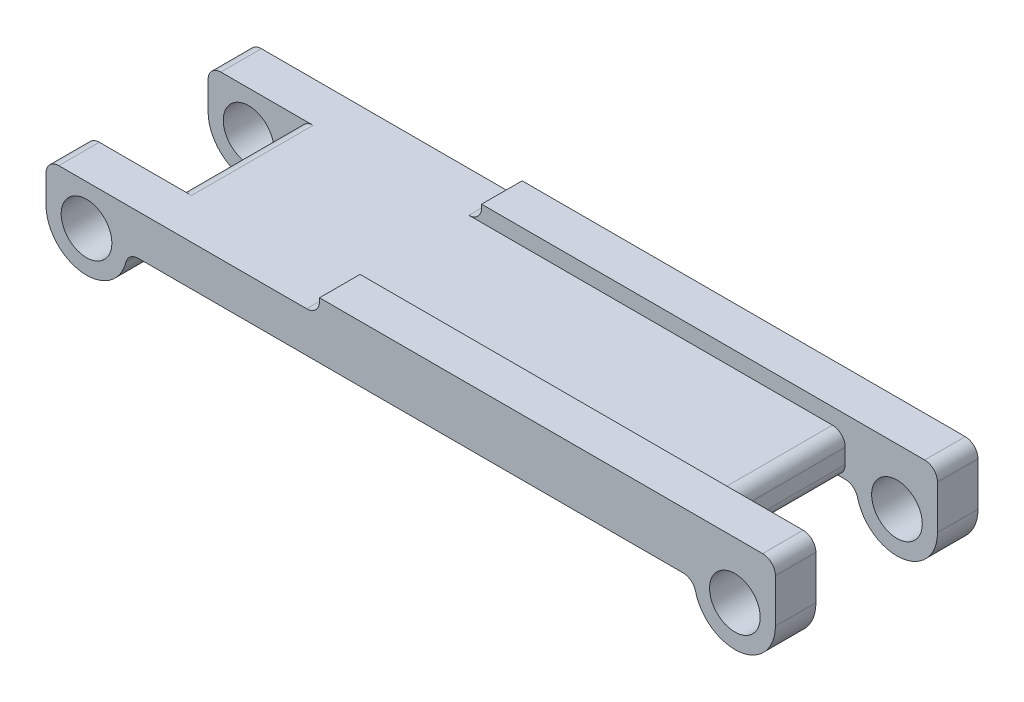
from build123d import *

# Parameters (mm, degrees)
SKETCH1_R           = 3.96875
BOSS_EXTRUDE1_DEPTH = 6.35
BOSS_EXTRUDE2_DEPTH = 19.05
SKETCH4_R           = 3.96875
BOSS_EXTRUDE3_DEPTH = 6.35


with BuildPart() as part:
    # Sketch1 → Boss-Extrude1 (new body)
    with BuildSketch(Plane.XY):
        with BuildLine():
            Line((105.95, 8.85), (36.5125, 8.85))
            Line((36.5125, 8.85), (36.5125, 8.35))
            ThreePointArc((36.5125, 8.35), (35.926713562, 6.935786438), (34.5125, 6.35))
            Line((34.5125, 6.35), (-4.35, 6.35))
            ThreePointArc((-4.35, 6.35), (-5.764213562, 5.764213562), (-6.35, 4.35))
            Line((-6.35, 4.35), (-6.35, 0))
            ThreePointArc((-6.35, 0), (-4.490128061, -4.490128061), (0, -6.35))
            ThreePointArc((0, -6.35), (3.915636357, -4.999029097), (6.165159082, -1.520958084))
            ThreePointArc((6.165159082, -1.520958084), (6.873670176, -0.425502647), (8.10694147, 0))
            Line((8.10694147, 0), (93.49305853, 0))
            ThreePointArc((93.49305853, 0), (94.726329824, -0.425502647), (95.434840918, -1.520958084))
            ThreePointArc((95.434840918, -1.520958084), (97.684363643, -4.999029097), (101.6, -6.35))
            ThreePointArc((101.6, -6.35), (106.090128061, -4.490128061), (107.95, 0))
            Line((107.95, 0), (107.95, 6.85))
            ThreePointArc((107.95, 6.85), (107.364213562, 8.264213562), (105.95, 8.85))
        make_face()
        Circle(SKETCH1_R, mode=Mode.SUBTRACT)
        with Locations((101.6, 0)):
            Circle(SKETCH1_R, mode=Mode.SUBTRACT)
    extrude(amount=BOSS_EXTRUDE1_DEPTH)

    # Sketch3 → Boss-Extrude2 (add)
    with BuildSketch(Plane.XY.offset(6.35)):
        with BuildLine():
            Line((91.49305853, 6.35), (10.10694147, 6.35))
            ThreePointArc((10.10694147, 6.35), (8.692727908, 5.764213562), (8.10694147, 4.35))
            Line((8.10694147, 4.35), (8.10694147, 2))
            ThreePointArc((8.10694147, 2), (8.692727908, 0.585786438), (10.10694147, 0))
            Line((10.10694147, 0), (91.49305853, 0))
            ThreePointArc((91.49305853, 0), (92.907272092, 0.585786438), (93.49305853, 2))
            Line((93.49305853, 2), (93.49305853, 4.35))
            ThreePointArc((93.49305853, 4.35), (92.907272092, 5.764213562), (91.49305853, 6.35))
        make_face()
    extrude(amount=BOSS_EXTRUDE2_DEPTH)

    # Sketch4 → Boss-Extrude3 (add)
    with BuildSketch(Plane.XY.offset(25.4)):
        with BuildLine():
            Line((-4.35, 6.35), (34.5125, 6.35))
            ThreePointArc((34.5125, 6.35), (35.926713562, 6.935786438), (36.5125, 8.35))
            Line((36.5125, 8.35), (36.5125, 8.85))
            Line((36.5125, 8.85), (105.95, 8.85))
            ThreePointArc((105.95, 8.85), (107.364213562, 8.264213562), (107.95, 6.85))
            Line((107.95, 6.85), (107.95, 0))
            ThreePointArc((107.95, 0), (106.090128061, -4.490128061), (101.6, -6.35))
            ThreePointArc((101.6, -6.35), (97.684363643, -4.999029097), (95.434840918, -1.520958084))
            ThreePointArc((95.434840918, -1.520958084), (94.726329824, -0.425502647), (93.49305853, 0))
            Line((93.49305853, 0), (8.10694147, 0))
            ThreePointArc((8.10694147, 0), (6.873670176, -0.425502647), (6.165159082, -1.520958084))
            ThreePointArc((6.165159082, -1.520958084), (3.915636357, -4.999029097), (0, -6.35))
            ThreePointArc((0, -6.35), (-4.490128061, -4.490128061), (-6.35, 0))
            Line((-6.35, 0), (-6.35, 4.35))
            ThreePointArc((-6.35, 4.35), (-5.764213562, 5.764213562), (-4.35, 6.35))
        make_face()
        Circle(SKETCH4_R, mode=Mode.SUBTRACT)
        with Locations((101.6, 0)):
            Circle(SKETCH4_R, mode=Mode.SUBTRACT)
    extrude(amount=BOSS_EXTRUDE3_DEPTH)


solid = part.part
